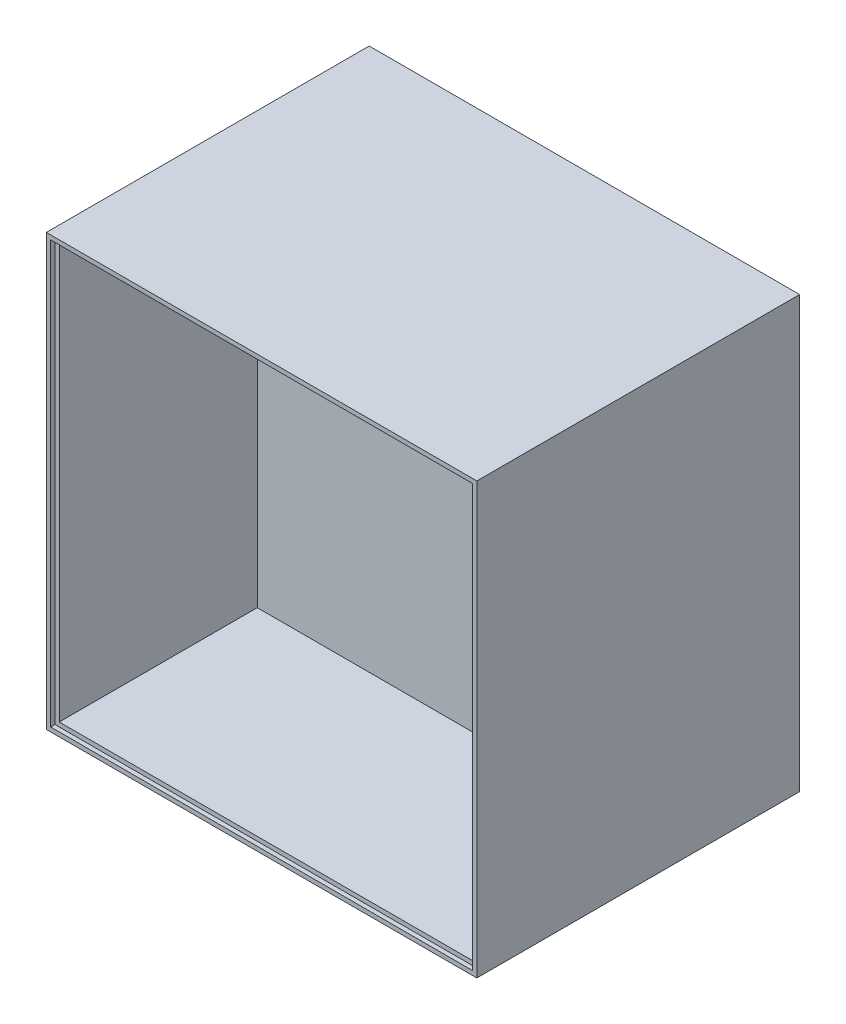
from build123d import *

# Parameters (mm, degrees)
SKETCH4_W           = 200
SKETCH4_H           = 200
BOSS_EXTRUDE1_DEPTH = 150
SKETCH6_W           = 196
SKETCH6_H           = 196
CUT_EXTRUDE1_DEPTH  = 2
SKETCH7_W           = 192
SKETCH7_H           = 192
CUT_EXTRUDE2_DEPTH  = 92


with BuildPart() as part:
    # Sketch4 → Boss-Extrude1 (new body)
    with BuildSketch(Plane.XY):
        with Locations((100, 100)):
            Rectangle(SKETCH4_W, SKETCH4_H)
    extrude(amount=BOSS_EXTRUDE1_DEPTH)

    # Sketch6 → Cut-Extrude1 (cut)
    with BuildSketch(Plane.XY.offset(150)):
        with Locations((100, 100)):
            Rectangle(SKETCH6_W, SKETCH6_H)
    extrude(amount=-CUT_EXTRUDE1_DEPTH, mode=Mode.SUBTRACT)

    # Sketch7 → Cut-Extrude2 (cut)
    with BuildSketch(Plane.XY.offset(148)):
        with Locations((100, 100)):
            Rectangle(SKETCH7_W, SKETCH7_H)
    extrude(amount=-CUT_EXTRUDE2_DEPTH, mode=Mode.SUBTRACT)


solid = part.part
